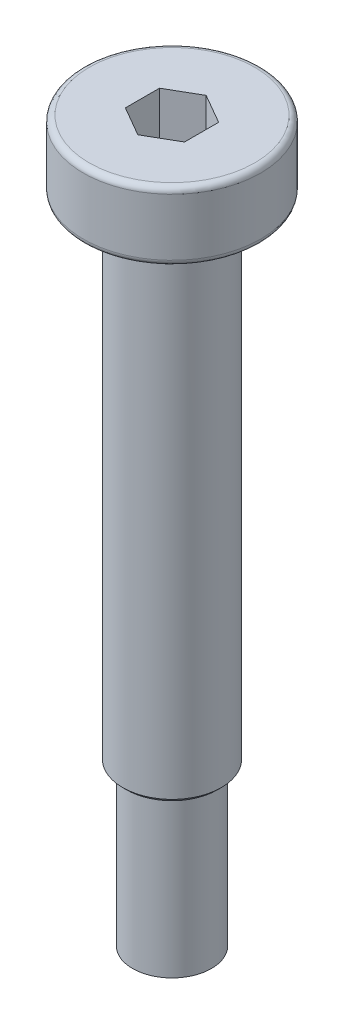
from build123d import *

# Parameters (mm, degrees)
FILLET_1_R          = 0.3
CUT_EXTRUDE_1_DEPTH = 2.4
CHAMFER_1_SIZE      = 0.2


with BuildPart() as part:
    # 草图1 → 旋转1 (revolve)
    with BuildSketch(Plane.XY):
        Polygon((0, 3.5), (-4.5, 3.5), (-4.5, 0), (-2.5, 0), (-2.5, -25), (-2, -25), (-2, -33), (0, -33), align=None)
    revolve(axis=Axis((0, 3.5, 0), (0, -1, 0)))

    # 圆角1
    fillet_1_edges = [part.edges().sort_by_distance(p)[0] for p in [
        (4.5, 3.5, 0),
        (4.5, 0, 0),
    ]]
    fillet(fillet_1_edges, radius=FILLET_1_R)

    # 草图2 → 切除-拉伸1 (cut)
    with BuildSketch(Plane(origin=(0, 3.5, 0), x_dir=(1, 0, 0), z_dir=(0, 1, 0))):
        Polygon((0, 1.732050808), (-1.5, 0.866025404), (-1.5, -0.866025404), (0, -1.732050808), (1.5, -0.866025404), (1.5, 0.866025404), align=None)
    extrude(amount=-CUT_EXTRUDE_1_DEPTH, mode=Mode.SUBTRACT)

    # 倒角1
    chamfer_1_edges = [part.edges().sort_by_distance(p)[0] for p in [
        (2.5, -25, 0),
    ]]
    chamfer(chamfer_1_edges, length=CHAMFER_1_SIZE)


solid = part.part
